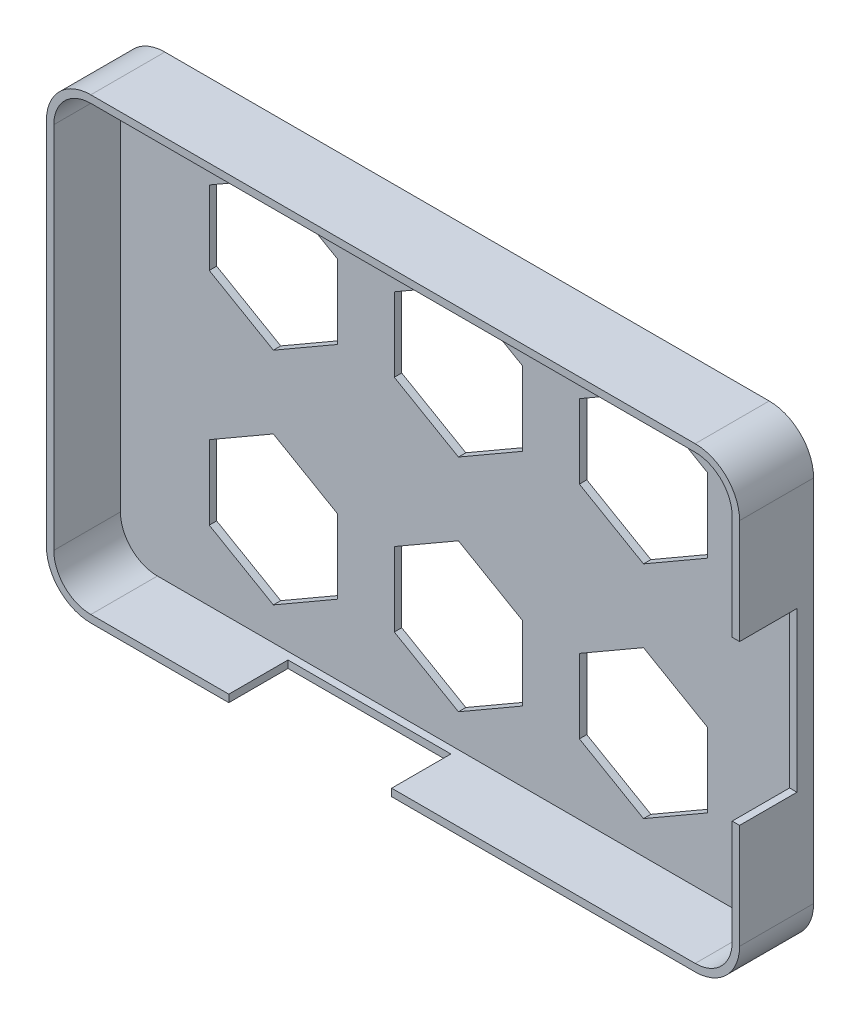
from build123d import *

# Parameters (mm, degrees)
SKIZZE1_W                       = 61.8
SKIZZE1_H                       = 93.64
AUFSATZ_LINEAR_AUSTRAGEN1_DEPTH = 10
VERRUNDUNG1_R                   = 6
WANDUNG1_T                      = -1
SKIZZE2_W                       = 21.5
SKIZZE2_H                       = 15.5
SCHNITT_LINEAR_AUSTRAGEN1_DEPTH = 6
SKIZZE3_W                       = 22
SKIZZE3_H                       = 8
SCHNITT_LINEAR_AUSTRAGEN2_DEPTH = 6
SCHNITT_LINEAR_AUSTRAGEN4_DEPTH = 6
LINEARES_MUSTER1_COUNT          = 3
LINEARES_MUSTER1_PITCH          = 25


with BuildPart() as part:
    # Skizze1 → Aufsatz-Linear austragen1 (new body)
    with BuildSketch(Plane(origin=(0, 0, 0), x_dir=(0, 1, 0), z_dir=(0, 0, 1))):
        Rectangle(SKIZZE1_W, SKIZZE1_H)
    extrude(amount=AUFSATZ_LINEAR_AUSTRAGEN1_DEPTH)

    # Verrundung1
    verrundung1_edges = [part.edges().sort_by_distance(p)[0] for p in [
        (46.82, 30.9, 5),
        (46.82, -30.9, 5),
        (-46.82, -30.9, 5),
        (-46.82, 30.9, 5),
    ]]
    fillet(verrundung1_edges, radius=VERRUNDUNG1_R)

    # Wandung1
    wandung1_openings = [part.faces().sort_by_distance(p)[0] for p in [
        (0, 0, 10),
    ]]
    offset(amount=WANDUNG1_T, openings=wandung1_openings, kind=Kind.INTERSECTION)

    # Skizze2 → Schnitt-Linear austragen1 (cut)
    with BuildSketch(Plane.YZ.offset(46.82)):
        with Locations((0, 10)):
            Rectangle(SKIZZE2_W, SKIZZE2_H)
    extrude(amount=-SCHNITT_LINEAR_AUSTRAGEN1_DEPTH, mode=Mode.SUBTRACT)

    # Skizze3 → Schnitt-Linear austragen2 (cut)
    with BuildSketch(Plane.XZ.offset(30.9)):
        with Locations((-11.18, 6)):
            Rectangle(SKIZZE3_W, SKIZZE3_H)
    extrude(amount=-SCHNITT_LINEAR_AUSTRAGEN2_DEPTH, mode=Mode.SUBTRACT)

    # Skizze4 → Schnitt-Linear austragen4 (cut)
    with BuildSketch(Plane(origin=(0, 0, 0), x_dir=(1, 0, 0), z_dir=(0, 0, -1))):
        Polygon((-25.159745962, 25.45), (-33.82, 20.45), (-33.82, 10.45), (-25.159745962, 5.45), (-16.499491924, 10.45), (-16.499491924, 20.45), align=None)
        Polygon((-25.159745962, -4.35), (-33.82, -9.35), (-33.82, -19.35), (-25.159745962, -24.35), (-16.499491924, -19.35), (-16.499491924, -9.35), align=None)
    schnitt_linear_austragen4 = extrude(amount=-SCHNITT_LINEAR_AUSTRAGEN4_DEPTH, mode=Mode.SUBTRACT)

    # Lineares Muster1: Schnitt-Linear austragen4 ×3
    with Locations(*[(i * LINEARES_MUSTER1_PITCH, 0, 0) for i in range(1, LINEARES_MUSTER1_COUNT)]):
        add(schnitt_linear_austragen4, mode=Mode.SUBTRACT)


solid = part.part
